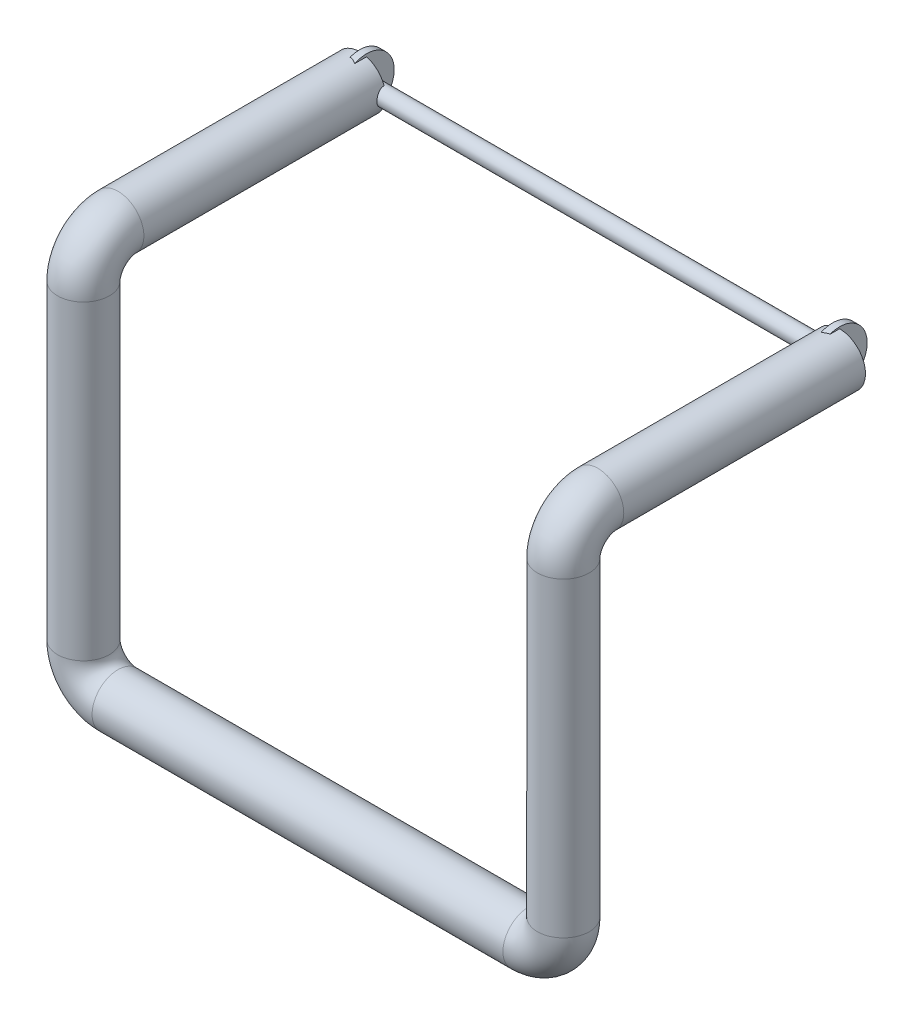
from build123d import *

# Parameters (mm, degrees)
SKETCH1_R           = 12.5
BOSS_EXTRUDE1_DEPTH = 337.5
SKETCH2_R           = 40
BOSS_EXTRUDE2_DEPTH = 10
SKETCH3_R           = 37.5
SKETCH3_R_2         = 29.372341665


with BuildPart() as part:
    # Sketch1 → Boss-Extrude1 (new, symmetric)
    with BuildSketch(Plane(origin=(0, 0, 0), x_dir=(0, 0, -1), z_dir=(1, 0, 0))):
        Circle(SKETCH1_R)
    extrude(amount=BOSS_EXTRUDE1_DEPTH, both=True)

    # Sketch2 → Boss-Extrude2 (add)
    with BuildSketch(Plane(origin=(337.5, 0, 0), x_dir=(0, 0, -1), z_dir=(1, 0, 0))):
        Circle(SKETCH2_R)
    boss_extrude2 = extrude(amount=BOSS_EXTRUDE2_DEPTH)

    # Sweep1: sweep along a curve in space
    with BuildLine() as sweep1_path:
        Line((347.5, 0, 0), (347.5, 0, 350))
        ThreePointArc((347.5, 0, 350), (347.5, -14.644660941, 385.355339059), (347.5, -50, 400))
        Line((347.5, -50, 400), (347.5, -500, 400))
        ThreePointArc((347.5, -500, 400), (332.855339059, -535.355339059, 400), (297.5, -550, 400))
        Line((297.5, -550, 400), (-2.5, -550, 400))
    # Sketch3 → Sweep1 (sweep)
    with BuildSketch(Plane.XY):
        with Locations((347.5, 0)):
            Circle(SKETCH3_R)
        with Locations((347.5, 0)):
            Circle(SKETCH3_R_2, mode=Mode.SUBTRACT)
    sweep1 = sweep(path=sweep1_path.line)

    # Mirror1: Boss-Extrude2, Sweep1 across plane
    add(boss_extrude2.mirror(Plane(origin=(0, 0, 0), x_dir=(0, 0, 1), z_dir=(1, 0, 0))))
    add(sweep1.mirror(Plane(origin=(0, 0, 0), x_dir=(0, 0, 1), z_dir=(1, 0, 0))))


solid = part.part
